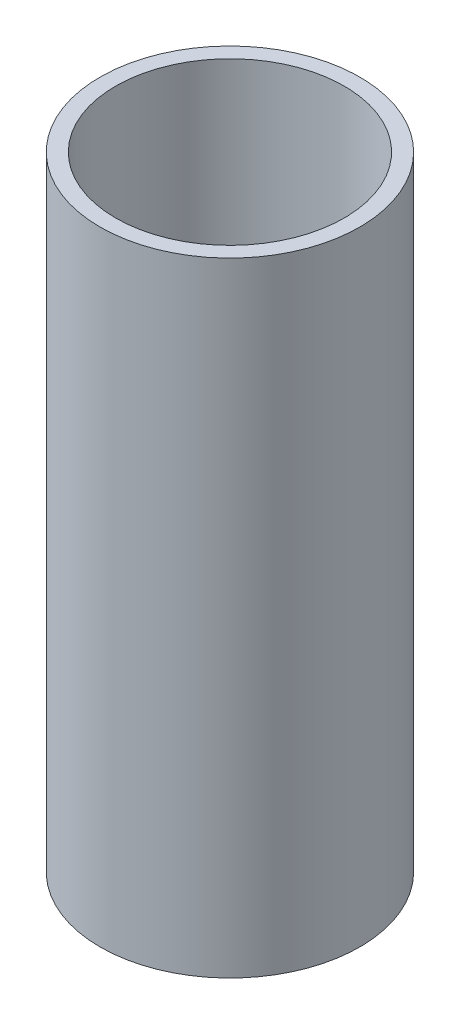
from build123d import *

# Parameters (mm, degrees)
SKETCH_1_R      = 25
SKETCH_1_R_2    = 22
EXTRUDE_1_DEPTH = 120


with BuildPart() as part:
    # 스케치1 → 보스-돌출1 (new body)
    with BuildSketch(Plane(origin=(0, 0, 0), x_dir=(1, 0, 0), z_dir=(0, 1, 0))):
        with Locations(Location((0, 0, 0), (0, 0, 270))):
            Circle(SKETCH_1_R)
        with Locations(Location((0, 0, 0), (0, 0, 270))):
            Circle(SKETCH_1_R_2, mode=Mode.SUBTRACT)
    extrude(amount=EXTRUDE_1_DEPTH)


solid = part.part
